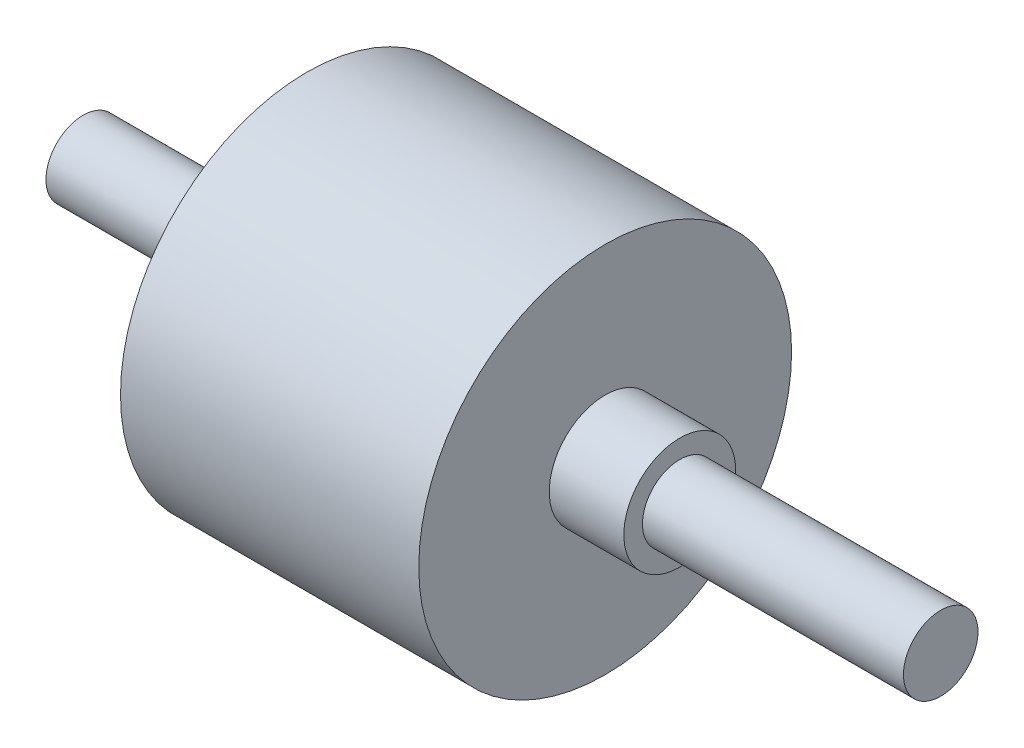
from build123d import *

# Parameters (mm, degrees)
SKETCH1_R                = 25
BOSS_EXTRUDE1_DEPTH      = 40
SKETCH2_R                = 7.5
BOSS_EXTRUDE2_DEPTH      = 10
BOSS_EXTRUDE3_DEPTH      = 35
BOSS_EXTRUDE3_DEPTH_BACK = 80
SKETCH3_R                = 5


with BuildPart() as part:
    # Sketch1 → Boss-Extrude1 (new body)
    with BuildSketch(Plane.YZ):
        with Locations(Location((0, 0, 0), (0, 0, 270))):
            Circle(SKETCH1_R)
    extrude(amount=BOSS_EXTRUDE1_DEPTH)

    # Sketch2 → Boss-Extrude2 (add)
    with BuildSketch(Plane.YZ.offset(40)):
        with Locations(Location((0, 0, 0), (0, 0, 270))):
            Circle(SKETCH2_R)
    extrude(amount=BOSS_EXTRUDE2_DEPTH)

    # Sketch3 → Boss-Extrude3 (add, two sides: drawn at the far end of the back side and taken through both)
    with BuildSketch(Plane.YZ.offset(50).offset(-BOSS_EXTRUDE3_DEPTH_BACK)):
        with Locations(Location((0, 0, 0), (0, 0, 270))):
            Circle(SKETCH3_R)
    extrude(amount=BOSS_EXTRUDE3_DEPTH + BOSS_EXTRUDE3_DEPTH_BACK)


solid = part.part
